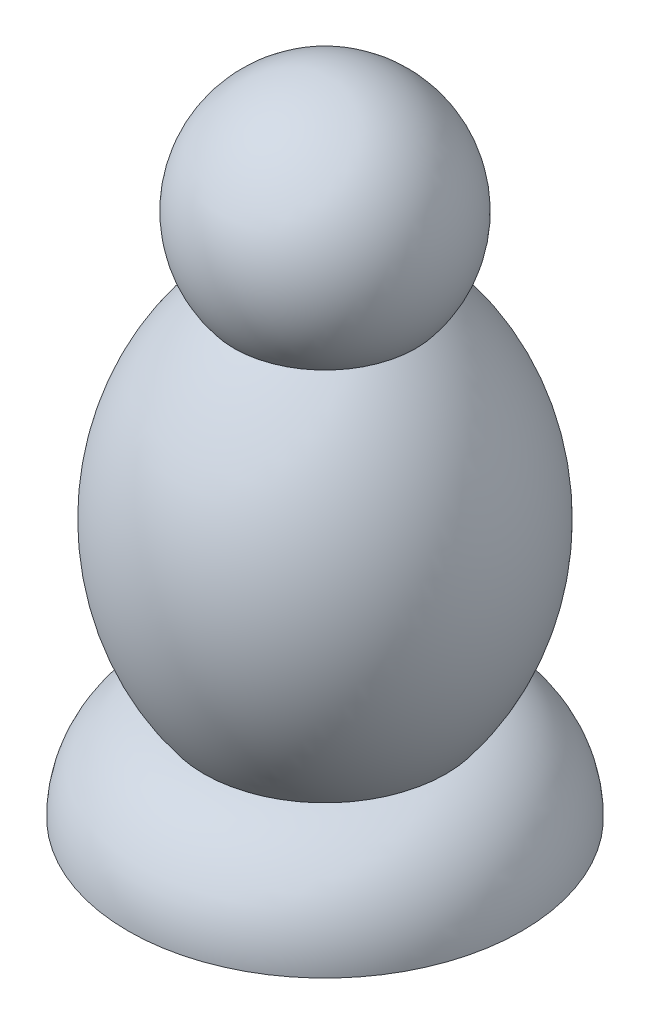
from build123d import *


with BuildPart() as part:
    # Sketch1 → Revolve1 (revolve)
    with BuildSketch(Plane.XY, mode=Mode.PRIVATE) as revolve1_sk:
        with BuildLine():
            Line((0, 0), (7.5, 0))
            ThreePointArc((7.5, 0), (6.693919622, 2.362967767), (4.61178063, 3.740675814))
            ThreePointArc((4.61178063, 3.740675814), (6.625248181, 10.694835038), (3.468820409, 17.210304767))
            ThreePointArc((3.468820409, 17.210304767), (4.01454927, 21.923150716), (0, 24.451417136))
            Line((0, 24.451417136), (0, 0))
        make_face()
    revolve(revolve1_sk.sketch.rotate(Axis((0, -23.585055485, 0), (0, 1, 0)), 90), axis=Axis((0, -23.585055485, 0), (0, 1, 0)))


solid = part.part
